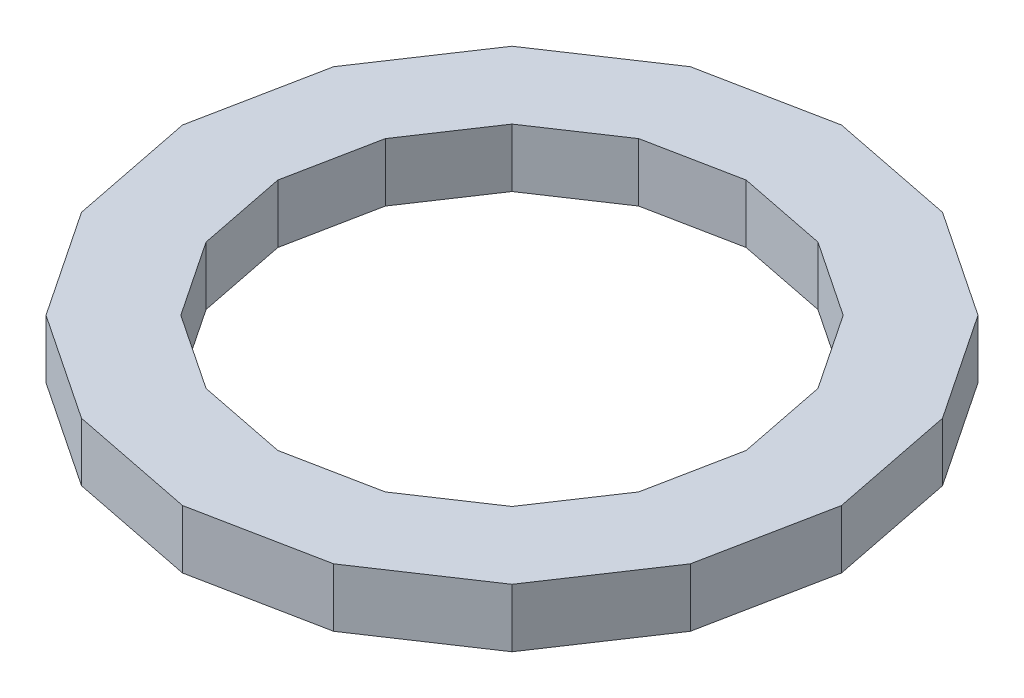
from build123d import *

# Parameters (mm, degrees)
BOSS_EXTRUDE1_DEPTH = 19.05


with BuildPart() as part:
    # Sketch1 → Boss-Extrude1 (new body)
    with BuildSketch(Plane(origin=(0, 0, 0), x_dir=(1, 0, 0), z_dir=(0, 1, 0))):
        Polygon((107.411786415, 0), (99.235551019, 41.104711102), (75.951602553, 75.951602553), (41.104711102, 99.235551019), (0, 107.411786415), (-41.104711102, 99.235551019), (-75.951602553, 75.951602553), (-99.235551019, 41.104711102), (-107.411786415, 0), (-99.235551019, -41.104711102), (-75.951602553, -75.951602553), (-41.104711102, -99.235551019), (0, -107.411786415), (41.104711102, -99.235551019), (75.951602553, -75.951602553), (99.235551019, -41.104711102), align=None)
        Polygon((76.334647913, 0), (70.524018828, 29.212005072), (53.976747179, 53.976747179), (29.212005072, 70.524018828), (0, 76.334647913), (-29.212005072, 70.524018828), (-53.976747179, 53.976747179), (-70.524018828, 29.212005072), (-76.334647913, 0), (-70.524018828, -29.212005072), (-53.976747179, -53.976747179), (-29.212005072, -70.524018828), (0, -76.334647913), (29.212005072, -70.524018828), (53.976747179, -53.976747179), (70.524018828, -29.212005072), align=None, mode=Mode.SUBTRACT)
    extrude(amount=BOSS_EXTRUDE1_DEPTH)


solid = part.part
